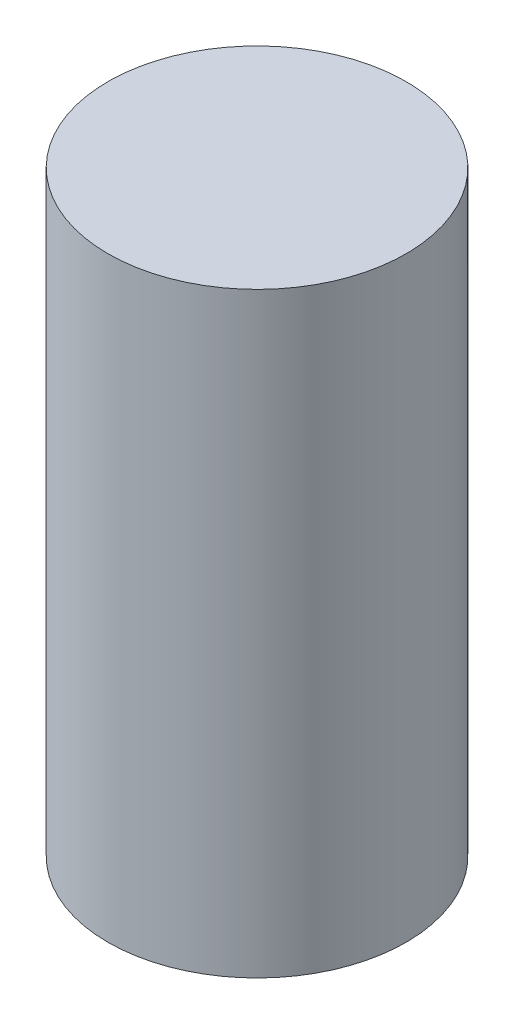
from build123d import *

# Parameters (mm, degrees)
ESBO_O1_R                = 15
RESSALTO_EXTRUS_O1_DEPTH = 60


with BuildPart() as part:
    # Esboço1 → Ressalto-extrusão1 (new body)
    with BuildSketch(Plane(origin=(0, 0, 0), x_dir=(1, 0, 0), z_dir=(0, 1, 0))):
        with Locations(Location((0, 0, 0), (0, 0, 270))):
            Circle(ESBO_O1_R)
    extrude(amount=RESSALTO_EXTRUS_O1_DEPTH)


solid = part.part
